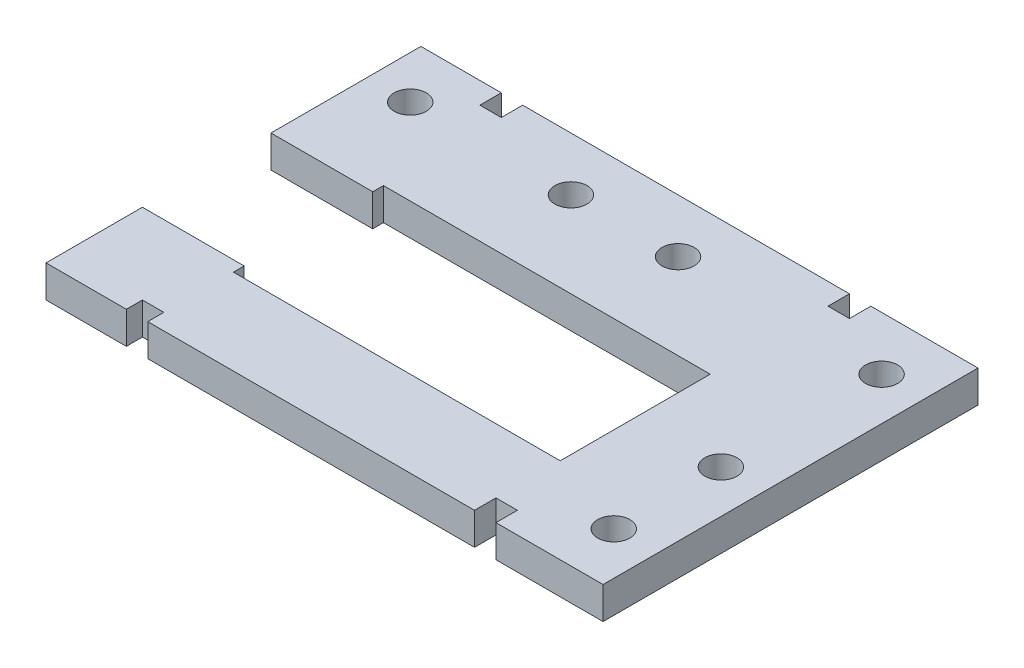
from build123d import *

# Parameters (mm, degrees)
SKETCH1_R           = 1.5
BOSS_EXTRUDE1_DEPTH = 3


with BuildPart() as part:
    # Sketch1 → Boss-Extrude1 (new body)
    with BuildSketch(Plane(origin=(0, 0, 0), x_dir=(1, 0, 0), z_dir=(0, 1, 0))):
        Polygon((0, 9), (0, 0), (7.5, 0), (7.5, 1.5), (9.5, 1.5), (9.5, 0), (40, 0), (40, 2), (42, 2), (42, 0), (52, 0), (52, 35), (42, 35), (42, 33), (40, 33), (40, 35), (9.5, 35), (9.5, 33), (7.5, 33), (7.5, 35), (0, 35), (0, 21), (9.5, 21), (9.5, 22), (40, 22), (40, 8), (9.5, 8), (9.5, 9), align=None)
        with Locations((48, 5)):
            Circle(SKETCH1_R, mode=Mode.SUBTRACT)
        with Locations((48, 15)):
            Circle(SKETCH1_R, mode=Mode.SUBTRACT)
        with Locations((4, 30)):
            Circle(SKETCH1_R, mode=Mode.SUBTRACT)
        with Locations((19, 30)):
            Circle(SKETCH1_R, mode=Mode.SUBTRACT)
        with Locations((29, 30)):
            Circle(SKETCH1_R, mode=Mode.SUBTRACT)
        with Locations((48, 30)):
            Circle(SKETCH1_R, mode=Mode.SUBTRACT)
    extrude(amount=BOSS_EXTRUDE1_DEPTH)


solid = part.part
